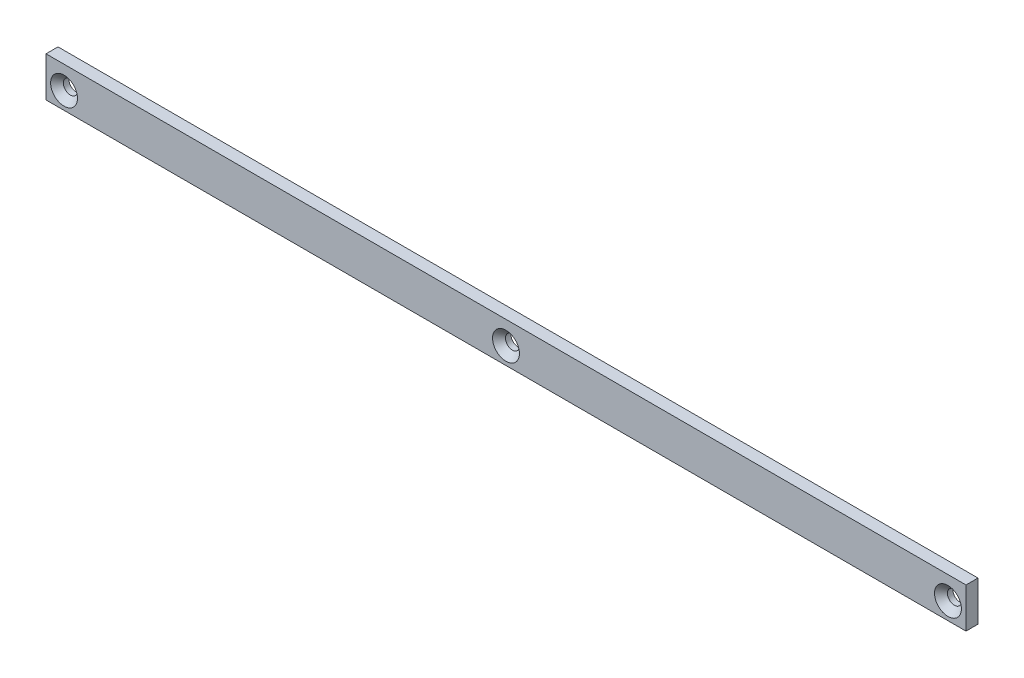
from build123d import *

# Parameters (mm, degrees)
CROQUIS1_W                                   = 230
CROQUIS1_H                                   = 10
CROQUIS1_R                                   = 1.75
CROQUIS1_R_2                                 = 1.768842751
SALIENTE_EXTRUIR1_DEPTH                      = 3
REFRENTADO_PARA_TORNILLO_TAP_N_CON_C_2_COUNT = 2
REFRENTADO_PARA_TORNILLO_TAP_N_CON_C_2_PITCH = 110.490700251
REFRENTADO_PARA_TORNILLO_TAP_N_CON_C_3_COUNT = 2
REFRENTADO_PARA_TORNILLO_TAP_N_CON_C_3_PITCH = 220.981400502


with BuildPart() as part:
    # Croquis1 → Saliente-Extruir1 (new body)
    with BuildSketch(Plane.XY):
        with Locations((0, 5)):
            Rectangle(CROQUIS1_W, CROQUIS1_H)
        with Locations((0, 4.279276807)):
            Circle(CROQUIS1_R, mode=Mode.SUBTRACT)
        with Locations((-110.490700251, 4.279276807)):
            Circle(CROQUIS1_R_2, mode=Mode.SUBTRACT)
        with Locations((110.490700251, 4.279276807)):
            Circle(CROQUIS1_R, mode=Mode.SUBTRACT)
    extrude(amount=SALIENTE_EXTRUIR1_DEPTH)

    # Croquis3 → Refrentado para tornillo tapón con cabeza plana de clavija de M31 (revolve, cut)
    with BuildSketch(Plane(origin=(-110.490700251, 4.279276807, 3), x_dir=(0, -1, 0), z_dir=(1, 0, 0))):
        Polygon((0, 0), (0, 3), (1.7, 3), (1.7, 1.66), (3.36, 0), align=None)
    refrentado_para_tornillo_tap_n_con_cabez = revolve(axis=Axis((-110.490700251, 4.279276807, 9.35), (0, 0, -1)), mode=Mode.SUBTRACT)

    # Refrentado para tornillo tap_n con c 2: Refrentado para tornillo tapón con cabeza plana de clavija de M31 ×2
    with Locations(*[(i * REFRENTADO_PARA_TORNILLO_TAP_N_CON_C_2_PITCH, 0, 0) for i in range(1, REFRENTADO_PARA_TORNILLO_TAP_N_CON_C_2_COUNT)]):
        add(refrentado_para_tornillo_tap_n_con_cabez, mode=Mode.SUBTRACT)

    # Refrentado para tornillo tap_n con c 3: Refrentado para tornillo tapón con cabeza plana de clavija de M31 ×2
    with Locations(*[(i * REFRENTADO_PARA_TORNILLO_TAP_N_CON_C_3_PITCH, 0, 0) for i in range(1, REFRENTADO_PARA_TORNILLO_TAP_N_CON_C_3_COUNT)]):
        add(refrentado_para_tornillo_tap_n_con_cabez, mode=Mode.SUBTRACT)


solid = part.part
